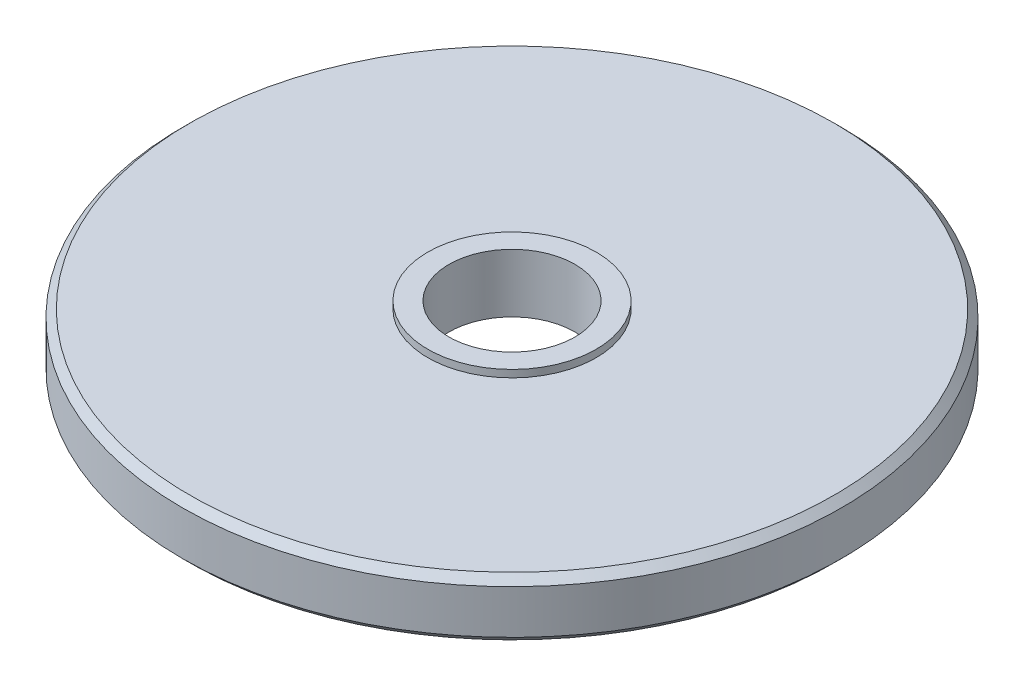
from build123d import *


with BuildPart() as part:
    # Эскиз1 → Повернуть1 (revolve)
    with BuildSketch(Plane.XY, mode=Mode.PRIVATE) as revolve_1_sk:
        Polygon((-8.6, 29.709317511), (-11.5, 29.709317511), (-11.5, 28.709317511), (-44, 28.709317511), (-45, 27.709317511), (-45, 21.709317511), (-44, 20.709317511), (-11, 20.709317511), (-11, 21.709317511), (-8.6, 21.709317511), align=None)
    revolve(revolve_1_sk.sketch.rotate(Axis((0, 0, 0), (0, 1, 0)), 270), axis=Axis((0, 0, 0), (0, 1, 0)))


solid = part.part
